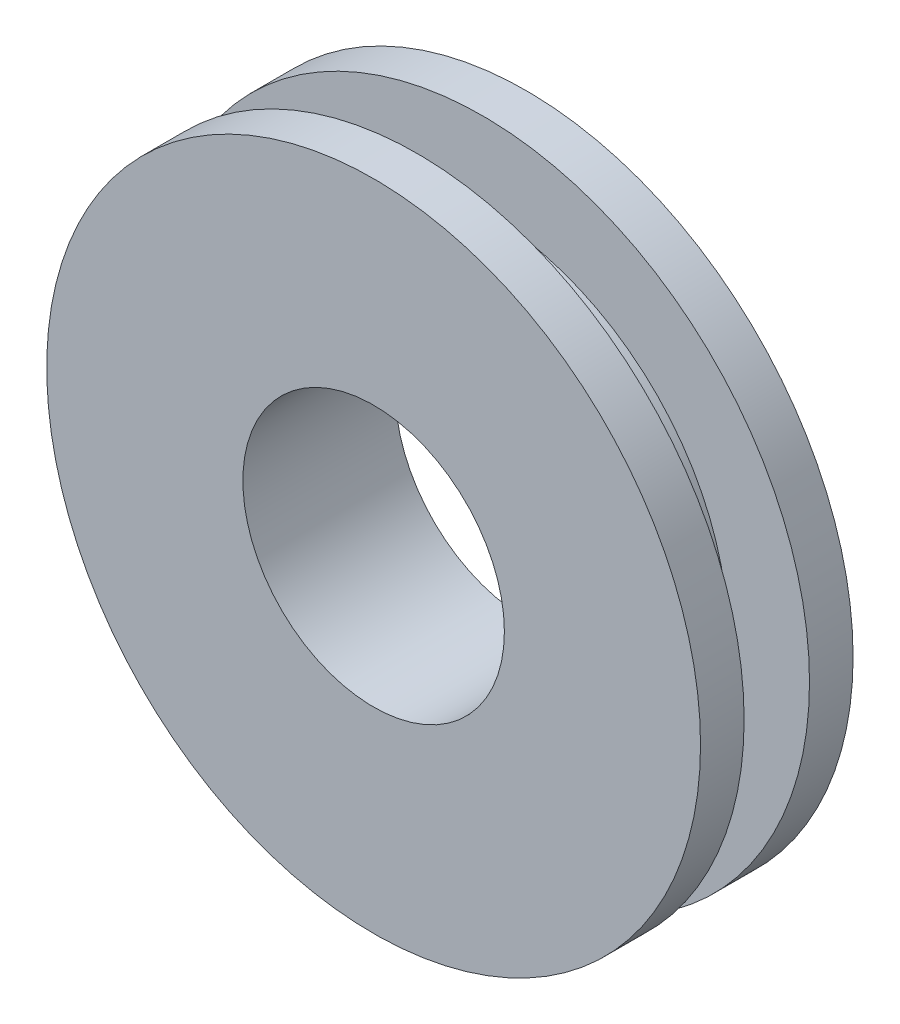
from build123d import *

# Parameters (mm, degrees)
SKETCH1_R           = 3
SKETCH1_R_2         = 2.25
SKETCH1_R_3         = 1.2
BOSS_EXTRUDE1_DEPTH = 0.4
BOSS_EXTRUDE4_START = 0.4
SKETCH1_8_R         = 2.25
SKETCH1_8_R_2       = 1.2
BOSS_EXTRUDE4_DEPTH = 0.6
BOSS_EXTRUDE5_START = 1
SKETCH1_9_R         = 3
SKETCH1_9_R_2       = 2.25
SKETCH1_9_R_3       = 1.2
BOSS_EXTRUDE5_DEPTH = 0.4


with BuildPart() as part:
    # Sketch1 → Boss-Extrude1 (new body)
    # profile 1 of 2: a face of its own
    with BuildSketch(Plane.XY):
        with Locations((8.485, 8.485)):
            Circle(SKETCH1_R)
        with Locations((8.485, 8.485)):
            Circle(SKETCH1_R_2, mode=Mode.SUBTRACT)
    # profile 2 of 2: a face of its own
    with BuildSketch(Plane.XY):
        with Locations((8.485, 8.485)):
            Circle(SKETCH1_R_2)
        with Locations((8.485, 8.485)):
            Circle(SKETCH1_R_3, mode=Mode.SUBTRACT)
    extrude(amount=BOSS_EXTRUDE1_DEPTH)

    # Sketch1<8> → Boss-Extrude4 (add)
    with BuildSketch(Plane.XY.offset(BOSS_EXTRUDE4_START)):
        with Locations((8.485, 8.485)):
            Circle(SKETCH1_8_R)
        with Locations((8.485, 8.485)):
            Circle(SKETCH1_8_R_2, mode=Mode.SUBTRACT)
    extrude(amount=BOSS_EXTRUDE4_DEPTH)

    # Sketch1<9> → Boss-Extrude5 (add)
    # profile 1 of 2: a face of its own
    with BuildSketch(Plane.XY.offset(BOSS_EXTRUDE5_START)):
        with Locations((8.485, 8.485)):
            Circle(SKETCH1_9_R)
        with Locations((8.485, 8.485)):
            Circle(SKETCH1_9_R_2, mode=Mode.SUBTRACT)
    # profile 2 of 2: a face of its own
    with BuildSketch(Plane.XY.offset(BOSS_EXTRUDE5_START)):
        with Locations((8.485, 8.485)):
            Circle(SKETCH1_9_R_2)
        with Locations((8.485, 8.485)):
            Circle(SKETCH1_9_R_3, mode=Mode.SUBTRACT)
    extrude(amount=BOSS_EXTRUDE5_DEPTH)


solid = part.part
